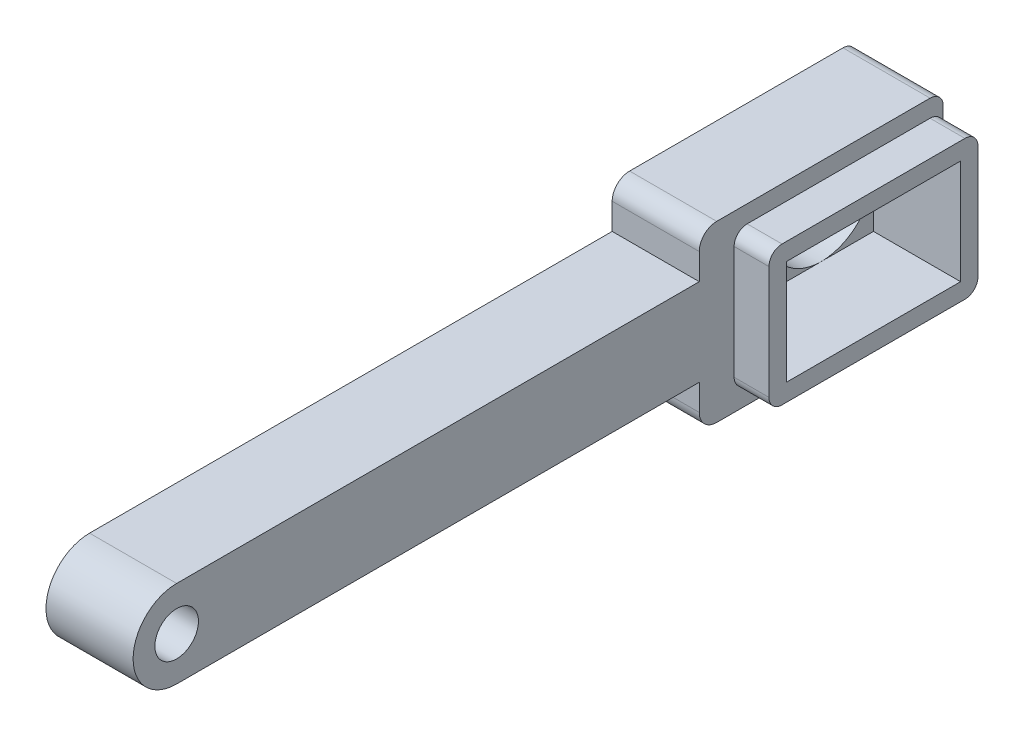
from build123d import *

# Parameters (mm, degrees)
BOSS_EXTRU_1_DEPTH           = 10
ESQUISSE3_R                  = 2.5
ENL_V_MAT_EXTRU_1_DEPTH      = 5
ENL_V_MAT_EXTRU_3_DEPTH      = 51.039984013
ENL_V_MAT_EXTRU_3_DEPTH_BACK = 51.039984013
ESQUISSE6_W                  = 20
ESQUISSE6_H                  = 12
ENL_V_MAT_EXTRU_4_DEPTH      = 6
ESQUISSE7_W                  = 20
ESQUISSE7_H                  = 12
BOSS_EXTRU_4_DEPTH           = 4


with BuildPart() as part:
    # Esquisse1 → Boss.-Extru.1 (new body)
    with BuildSketch(Plane(origin=(0, 0, 0), x_dir=(0, 0, -1), z_dir=(1, 0, 0))):
        with BuildLine():
            Line((0, 5), (-40, 5))
            ThreePointArc((-40, 5), (-45, 0), (-40, -5))
            Line((-40, -5), (0, -5))
            Line((0, -5), (20, -5))
            Line((20, -5), (20, -8))
            ThreePointArc((20, -8), (20.585786438, -9.414213562), (22, -10))
            Line((22, -10), (40, -10))
            Line((40, -10), (46.5, -10))
            ThreePointArc((46.5, -10), (47.560660172, -9.560660172), (48, -8.5))
            Line((48, -8.5), (48, 8.5))
            ThreePointArc((48, 8.5), (47.560660172, 9.560660172), (46.5, 10))
            Line((46.5, 10), (40, 10))
            Line((40, 10), (22, 10))
            ThreePointArc((22, 10), (20.585786438, 9.414213562), (20, 8))
            Line((20, 8), (20, 5))
            Line((20, 5), (0, 5))
        make_face()
    extrude(amount=BOSS_EXTRU_1_DEPTH)

    # Esquisse3 → Enlèv. mat.-Extru.1 (cut)
    with BuildSketch(Plane(origin=(10, 0, 0), x_dir=(0, 0, -1), z_dir=(1, 0, 0))):
        with Locations((-40, 0)):
            Circle(ESQUISSE3_R)
    extrude(amount=-ENL_V_MAT_EXTRU_1_DEPTH, mode=Mode.SUBTRACT)

    # Esquisse4 → Enlèv. mat.-Extru.3 (cut, two sides: drawn at the far end of the back side and taken through both)
    with BuildSketch(Plane(origin=(10, 0, 0), x_dir=(0, 0, -1), z_dir=(1, 0, 0)).offset(-ENL_V_MAT_EXTRU_3_DEPTH_BACK)):
        with BuildLine():
            ThreePointArc((35.333333333, 3.771236166), (46, 0), (35.333333333, -3.771236166))
            ThreePointArc((35.333333333, -3.771236166), (30, 0), (35.333333333, 3.771236166))
        make_face()
    extrude(amount=ENL_V_MAT_EXTRU_3_DEPTH + ENL_V_MAT_EXTRU_3_DEPTH_BACK, mode=Mode.SUBTRACT)

    # Esquisse6 → Enlèv. mat.-Extru.4 (cut)
    with BuildSketch(Plane(origin=(10, 0, 0), x_dir=(0, 0, -1), z_dir=(1, 0, 0))):
        with Locations((36, 0)):
            Rectangle(ESQUISSE6_W, ESQUISSE6_H)
    extrude(amount=-ENL_V_MAT_EXTRU_4_DEPTH, mode=Mode.SUBTRACT)

    # Esquisse7 → Boss.-Extru.4 (add)
    with BuildSketch(Plane(origin=(10, 0, 0), x_dir=(0, 0, -1), z_dir=(1, 0, 0))):
        with BuildLine():
            ThreePointArc((25.5, 8), (24.439339828, 7.560660172), (24, 6.5))
            Line((24, 6.5), (24, -6.5))
            ThreePointArc((24, -6.5), (24.439339828, -7.560660172), (25.5, -8))
            Line((25.5, -8), (46.5, -8))
            ThreePointArc((46.5, -8), (47.560660172, -7.560660172), (48, -6.5))
            Line((48, -6.5), (48, 6.5))
            ThreePointArc((48, 6.5), (47.560660172, 7.560660172), (46.5, 8))
            Line((46.5, 8), (25.5, 8))
        make_face()
        with Locations((36, 0)):
            Rectangle(ESQUISSE7_W, ESQUISSE7_H, mode=Mode.SUBTRACT)
    extrude(amount=BOSS_EXTRU_4_DEPTH)


solid = part.part
